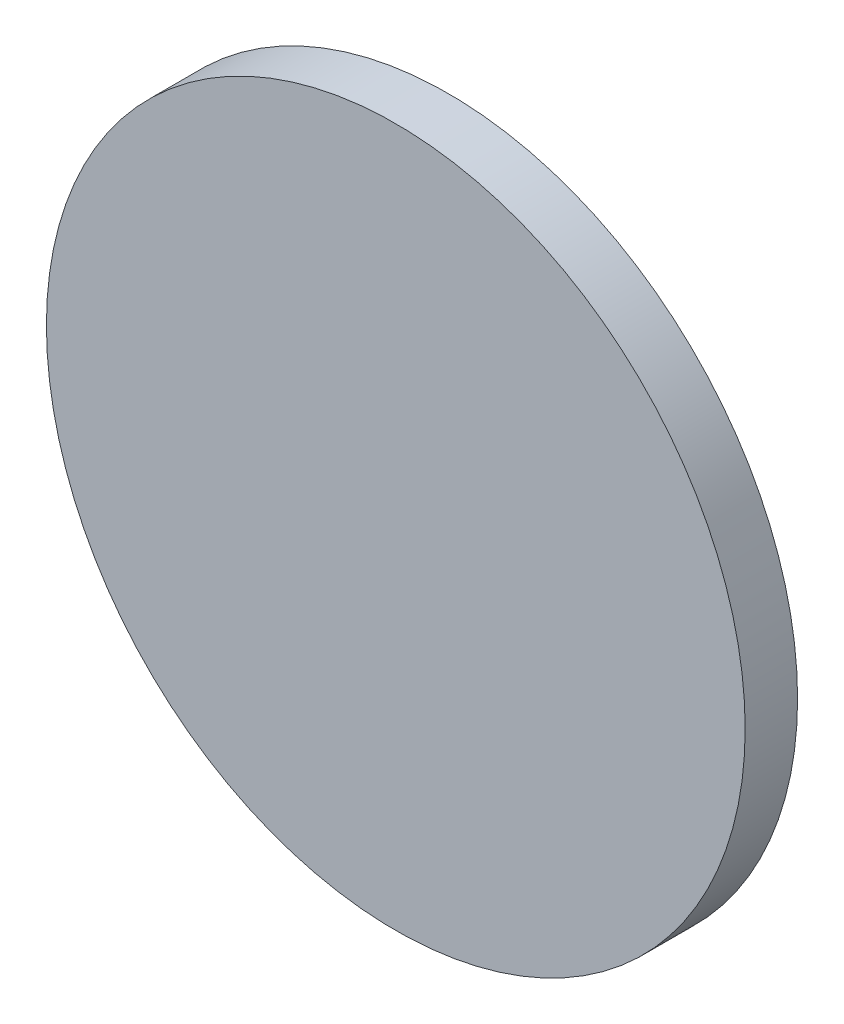
from build123d import *

# Parameters (mm, degrees)
ESQUISSE1_R        = 20
BOSS_EXTRU_1_DEPTH = 3


with BuildPart() as part:
    # Esquisse1 → Boss.-Extru.1 (new body)
    with BuildSketch(Plane.XY):
        Circle(ESQUISSE1_R)
    extrude(amount=BOSS_EXTRU_1_DEPTH)


solid = part.part
